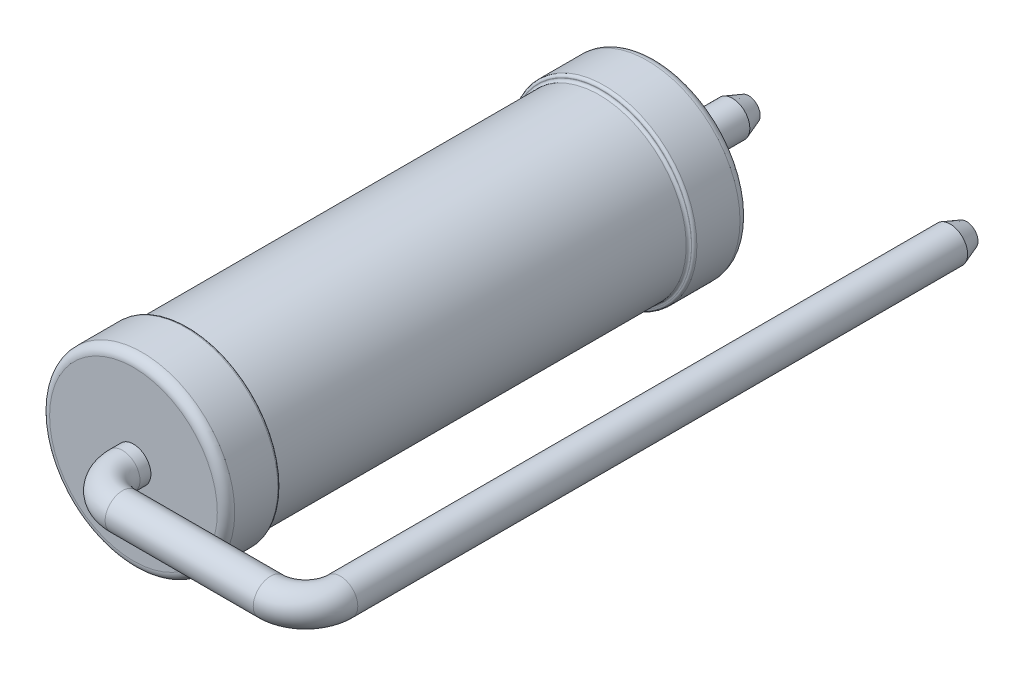
from build123d import *
from OCP.BRepFilletAPI import BRepFilletAPI_MakeChamfer

# Parameters (mm, degrees)
SKETCH3_R      = 0.4064
CHAMFER1_SIZE  = 0.381
CHAMFER1_SIZE2 = 0.138672659


with BuildPart() as part:
    # Sketch1 → Revolve1 (revolve)
    with BuildSketch(Plane(origin=(0, 0, 0), x_dir=(1, 0, 0), z_dir=(0, 1, 0))):
        with BuildLine():
            Line((-2.54, -12.446), (-4.4958, -12.446))
            ThreePointArc((-4.4958, -12.446), (-4.639484098, -12.386484098), (-4.699, -12.2428))
            Line((-4.699, -12.2428), (-4.699, -11.23696))
            ThreePointArc((-4.699, -11.23696), (-4.681145229, -11.193854771), (-4.63804, -11.176))
            Line((-4.63804, -11.176), (-4.63296, -11.176))
            ThreePointArc((-4.63296, -11.176), (-4.589854771, -11.158145229), (-4.572, -11.11504))
            Line((-4.572, -11.11504), (-4.572, -1.58496))
            ThreePointArc((-4.572, -1.58496), (-4.589854771, -1.541854771), (-4.63296, -1.524))
            Line((-4.63296, -1.524), (-4.63804, -1.524))
            ThreePointArc((-4.63804, -1.524), (-4.681145229, -1.506145229), (-4.699, -1.46304))
            Line((-4.699, -1.46304), (-4.699, -0.4572))
            ThreePointArc((-4.699, -0.4572), (-4.639484098, -0.313515902), (-4.4958, -0.254))
            Line((-4.4958, -0.254), (-2.54, -0.254))
            Line((-2.54, -0.254), (-2.54, -12.446))
        make_face()
    revolve(axis=Axis((-2.54, 0, 0.254), (0, 0, 1)))

    # Sweep1: sweep along a path in Sketch2
    with BuildLine(Plane(origin=(0, 0, 0), x_dir=(1, 0, 0), z_dir=(0, 1, 0))) as sweep1_path:
        Line((2.54, 1.905), (2.54, -12.7))
        ThreePointArc((2.54, -12.7), (2.301936392, -13.274736392), (1.7272, -13.5128))
        Line((1.7272, -13.5128), (-1.7272, -13.5128))
        ThreePointArc((-1.7272, -13.5128), (-2.301936392, -13.274736392), (-2.54, -12.7))
        Line((-2.54, -12.7), (-2.54, 1.905))
    # Sketch3 → Sweep1 (sweep)
    with BuildSketch(Plane.XY.offset(-1.905)):
        with Locations((2.54, 0)):
            Circle(SKETCH3_R)
    sweep(path=sweep1_path.line)

    # Chamfer1: one chamfer whose edges measure the first distance from different faces: ONE call of the kernel's chamfer builder (chamfer() names one face for all edges)
    chamfer1_edges_1 = [part.edges().sort_by_distance(p)[0] for p in [
        (2.1336, 0, -1.905),
    ]]
    chamfer1_side_1 = [part.faces().sort_by_distance(p)[0] for p in [
        (2.1336, 0, 5.3975),
    ]]
    chamfer1_edges_2 = [part.edges().sort_by_distance(p)[0] for p in [
        (-2.1336, 0, -1.905),
    ]]
    chamfer1_side_2 = [part.faces().sort_by_distance(p)[0] for p in [
        (-2.1336, 0, -0.8255),
    ]]
    chamfer1 = BRepFilletAPI_MakeChamfer(part.part.solid().wrapped)
    for e in chamfer1_edges_1:
        chamfer1.Add(CHAMFER1_SIZE, CHAMFER1_SIZE2, e.wrapped, chamfer1_side_1[0].wrapped)  # the first distance lies on this face
    for e in chamfer1_edges_2:
        chamfer1.Add(CHAMFER1_SIZE, CHAMFER1_SIZE2, e.wrapped, chamfer1_side_2[0].wrapped)  # the first distance lies on this face
    add(Compound.cast(chamfer1.Shape()), mode=Mode.REPLACE)


solid = part.part
